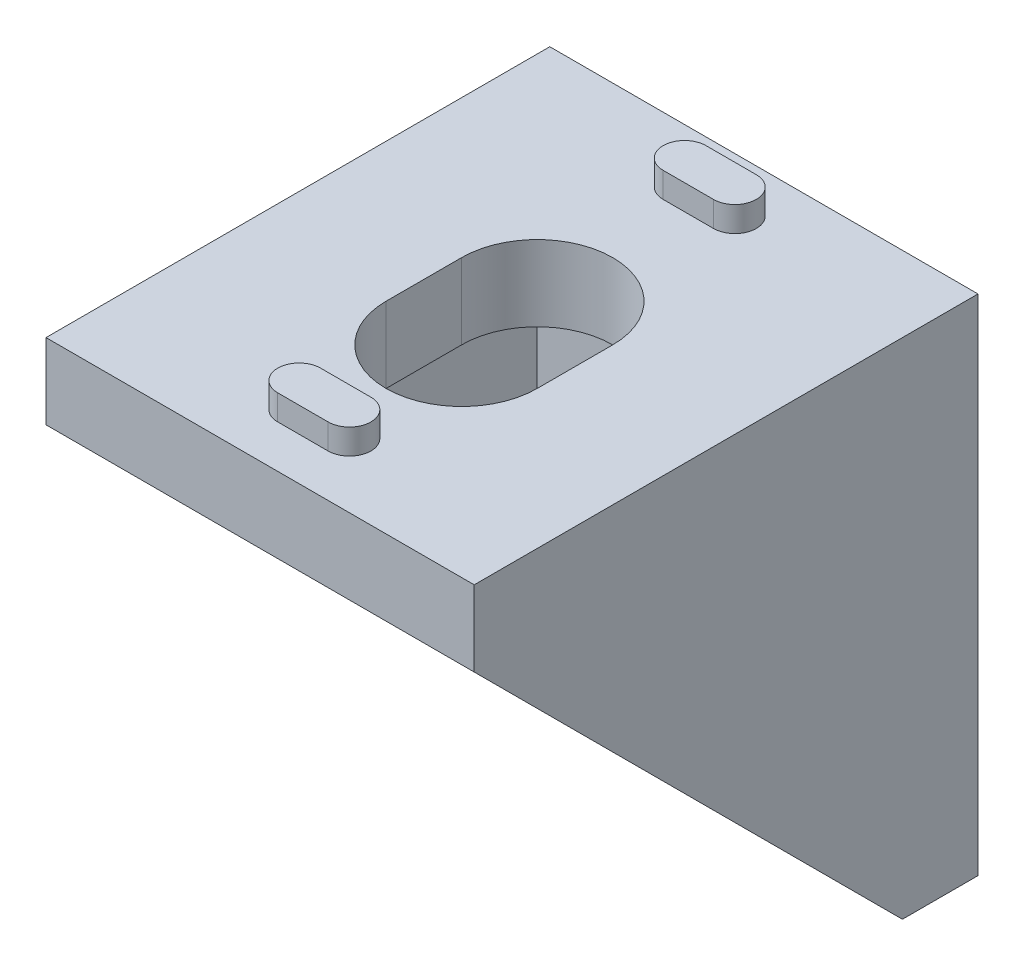
from build123d import *

# Parameters (mm, degrees)
BOSS_EXTRUDE1_DEPTH = 8.5
SKETCH2_W           = 17
SKETCH2_H           = 17
CUT_EXTRUDE1_DEPTH  = 6
CUT_EXTRUDE2_REACH  = 29.591
BOSS_EXTRUDE2_DEPTH = 1


with BuildPart() as part:
    # Sketch1 → Boss-Extrude1 (new, symmetric)
    with BuildSketch(Plane(origin=(0, 0, 0), x_dir=(0, 0, -1), z_dir=(1, 0, 0))):
        Polygon((0, 0), (-20, 0), (-20, -3), (-11.5, -11.5), (-3, -20), (0, -20), align=None)
    extrude(amount=BOSS_EXTRUDE1_DEPTH, both=True)

    # Sketch2 → Cut-Extrude1 (cut, symmetric)
    with BuildSketch(Plane(origin=(0, 0, 0), x_dir=(0, 0, -1), z_dir=(1, 0, 0))):
        with Locations((-11.5, -11.5)):
            Rectangle(SKETCH2_W, SKETCH2_H)
    extrude(amount=CUT_EXTRUDE1_DEPTH, both=True, mode=Mode.SUBTRACT)

    # Sketch3 → Cut-Extrude2 (cut, up to next)
    with BuildSketch(Plane.XY.offset(3), mode=Mode.PRIVATE) as cut_extrude2_sk1:
        with BuildLine():
            Line((-3, -9), (-3, -12))
            ThreePointArc((-3, -12), (0, -15), (3, -12))
            Line((3, -12), (3, -9))
            ThreePointArc((3, -9), (0, -6), (-3, -9))
        make_face()
    cut_extrude2_tool1 = extrude(cut_extrude2_sk1.sketch, amount=-CUT_EXTRUDE2_REACH, mode=Mode.PRIVATE) & part.part
    cut_extrude2 = cut_extrude2_tool1.solids().sort_by_distance((0, -10.5, 3))[0]
    add(cut_extrude2, mode=Mode.SUBTRACT)

    # Sketch4 → Boss-Extrude2 (add)
    with BuildSketch(Plane(origin=(0, 0, 0), x_dir=(-1, 0, 0), z_dir=(0, 0, -1))):
        with BuildLine():
            Line((-1, -3), (1, -3))
            ThreePointArc((1, -3), (1.85, -2.15), (1, -1.3))
            Line((1, -1.3), (-1, -1.3))
            ThreePointArc((-1, -1.3), (-1.85, -2.15), (-1, -3))
        make_face()
        with BuildLine():
            Line((-1, -18.3), (1, -18.3))
            ThreePointArc((1, -18.3), (1.85, -17.45), (1, -16.6))
            Line((1, -16.6), (-1, -16.6))
            ThreePointArc((-1, -16.6), (-1.85, -17.45), (-1, -18.3))
        make_face()
    boss_extrude2 = extrude(amount=BOSS_EXTRUDE2_DEPTH)

    # Mirror1: Cut-Extrude2, Boss-Extrude2 across plane
    add(cut_extrude2.mirror(Plane(origin=(0, 0, 0), x_dir=(0, -0.7071067811865481, 0.707106781186547), z_dir=(0, 0.7071067811865471, 0.707106781186548))), mode=Mode.SUBTRACT)
    add(boss_extrude2.mirror(Plane(origin=(0, 0, 0), x_dir=(0, -0.7071067811865481, 0.707106781186547), z_dir=(0, 0.7071067811865471, 0.707106781186548))))


solid = part.part
